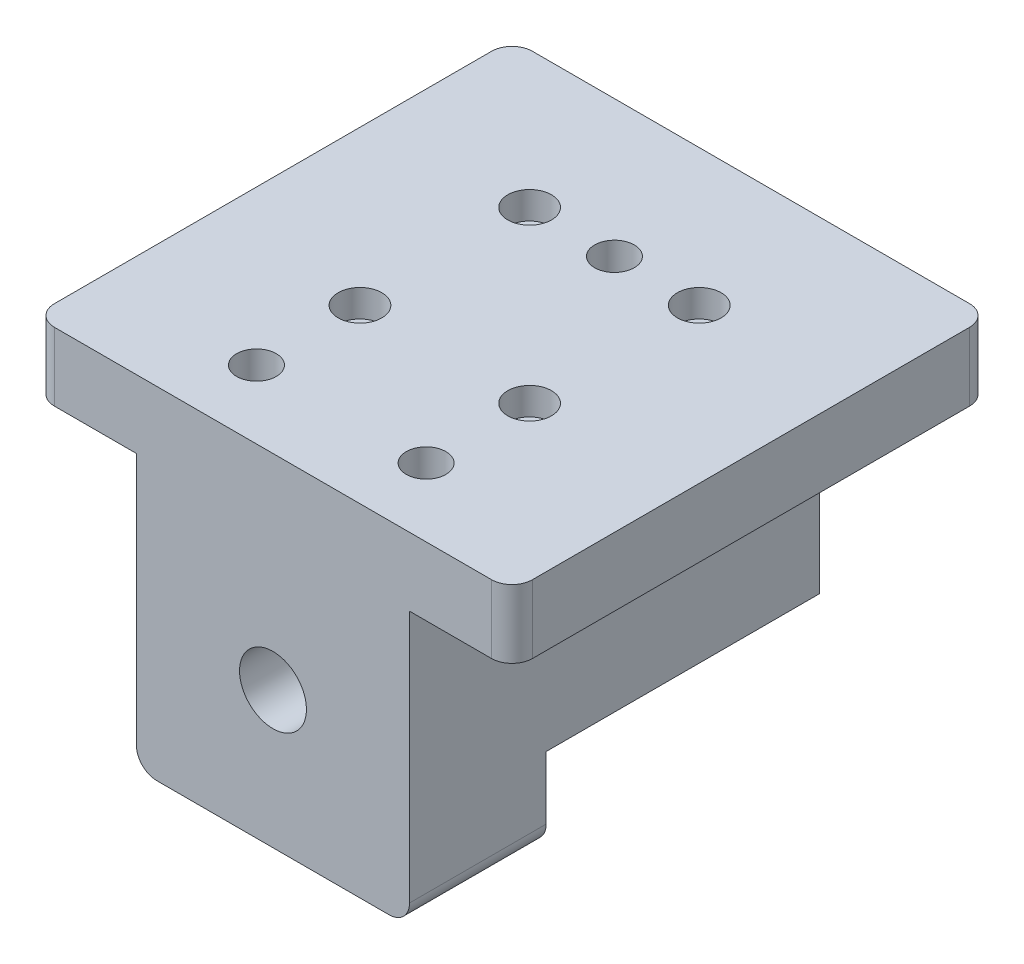
from build123d import *

# Parameters (mm, degrees)
SKETCH1_R                = 2.45
BOSS_EXTRUDE1_DEPTH      = 10
BOSS_EXTRUDE2_DEPTH      = 10
BOSS_EXTRUDE2_DEPTH_BACK = 20
SKETCH7_W                = 35
SKETCH7_H                = 35
BOSS_EXTRUDE10_DEPTH     = 5
SKETCH9_R                = 1.6
CUT_EXTRUDE1_DEPTH       = 2
SKETCH12_R               = 1.45
CUT_EXTRUDE2_DEPTH       = 40.538462287
FILLET3_R                = 1.5


with BuildPart() as part:
    # Sketch1 → Boss-Extrude1 (new body)
    with BuildSketch(Plane.XY):
        with BuildLine():
            ThreePointArc((4.796070709, -3.512623741), (4.371196116, -2.876753977), (4.222, -2.126694449))
            Line((4.222, -2.126694449), (4.222, 1.814694449))
            ThreePointArc((4.222, 1.814694449), (4.371196116, 2.564753977), (4.796070709, 3.20062374))
            Line((4.796070709, 3.20062374), (6.743336362, 5.147889394))
            ThreePointArc((6.743336362, 5.147889394), (6.838716827, 5.211620582), (6.951225756, 5.234))
            Line((6.951225756, 5.234), (8.142, 5.234))
            ThreePointArc((8.142, 5.234), (8.349889394, 5.147889394), (8.436, 4.94))
            Line((8.436, 4.94), (8.436, 3.176))
            ThreePointArc((8.436, 3.176), (8.522110606, 2.968110606), (8.73, 2.882))
            Line((8.73, 2.882), (9.416, 2.882))
            ThreePointArc((9.416, 2.882), (9.623889394, 2.968110606), (9.71, 3.176))
            Line((9.71, 3.176), (9.71, 3.528))
            Line((9.71, 3.528), (9.906, 3.528))
            ThreePointArc((9.906, 3.528), (10.113889394, 3.614110606), (10.2, 3.822))
            Line((10.2, 3.822), (10.2, 8.052))
            Line((10.2, 8.052), (10.2, 9.922))
            Line((10.2, 9.922), (8.608, 9.922))
            Line((8.608, 9.922), (4.1, 9.922))
            ThreePointArc((4.1, 9.922), (3.892110606, 9.835889394), (3.806, 9.628))
            Line((3.806, 9.628), (3.806, 9.432))
            Line((3.806, 9.432), (3.454, 9.432))
            ThreePointArc((3.454, 9.432), (3.246110606, 9.345889394), (3.16, 9.138))
            Line((3.16, 9.138), (3.16, 8.452))
            ThreePointArc((3.16, 8.452), (3.246110606, 8.244110606), (3.454, 8.158))
            Line((3.454, 8.158), (5.218, 8.158))
            ThreePointArc((5.218, 8.158), (5.425889394, 8.071889394), (5.512, 7.864))
            Line((5.512, 7.864), (5.512, 6.673225756))
            ThreePointArc((5.512, 6.673225756), (5.489620583, 6.560716827), (5.425889394, 6.465336362))
            Line((5.425889394, 6.465336362), (3.478623741, 4.518070709))
            ThreePointArc((3.478623741, 4.518070709), (2.842753977, 4.093196116), (2.092694449, 3.944))
            Line((2.092694449, 3.944), (-1.848694449, 3.944))
            ThreePointArc((-1.848694449, 3.944), (-2.598753977, 4.093196116), (-3.234623741, 4.518070709))
            Line((-3.234623741, 4.518070709), (-5.181889394, 6.465336362))
            ThreePointArc((-5.181889394, 6.465336362), (-5.245620582, 6.560716827), (-5.268, 6.673225756))
            Line((-5.268, 6.673225756), (-5.268, 7.864))
            ThreePointArc((-5.268, 7.864), (-5.181889394, 8.071889394), (-4.974, 8.158))
            Line((-4.974, 8.158), (-3.21, 8.158))
            ThreePointArc((-3.21, 8.158), (-3.002110606, 8.244110606), (-2.916, 8.452))
            Line((-2.916, 8.452), (-2.916, 9.138))
            ThreePointArc((-2.916, 9.138), (-3.002110606, 9.345889394), (-3.21, 9.432))
            Line((-3.21, 9.432), (-3.406, 9.432))
            Line((-3.406, 9.432), (-3.406, 9.628))
            ThreePointArc((-3.406, 9.628), (-3.492110606, 9.835889394), (-3.7, 9.922))
            Line((-3.7, 9.922), (-8.33, 9.922))
            Line((-8.33, 9.922), (-9.8, 9.922))
            Line((-9.8, 9.922), (-9.8, 8.33))
            Line((-9.8, 8.33), (-9.8, 3.822))
            ThreePointArc((-9.8, 3.822), (-9.713889394, 3.614110606), (-9.506, 3.528))
            Line((-9.506, 3.528), (-9.31, 3.528))
            Line((-9.31, 3.528), (-9.31, 3.176))
            ThreePointArc((-9.31, 3.176), (-9.223889394, 2.968110606), (-9.016, 2.882))
            Line((-9.016, 2.882), (-8.33, 2.882))
            ThreePointArc((-8.33, 2.882), (-8.122110606, 2.968110606), (-8.036, 3.176))
            Line((-8.036, 3.176), (-8.036, 4.94))
            ThreePointArc((-8.036, 4.94), (-7.949889394, 5.147889394), (-7.742, 5.234))
            Line((-7.742, 5.234), (-6.551225756, 5.234))
            ThreePointArc((-6.551225756, 5.234), (-6.438716827, 5.211620582), (-6.343336362, 5.147889394))
            Line((-6.343336362, 5.147889394), (-4.396070709, 3.20062374))
            ThreePointArc((-4.396070709, 3.20062374), (-3.971196116, 2.564753977), (-3.822, 1.814694449))
            Line((-3.822, 1.814694449), (-3.822, -2.126694449))
            ThreePointArc((-3.822, -2.126694449), (-3.971196116, -2.876753977), (-4.396070709, -3.512623741))
            Line((-4.396070709, -3.512623741), (-6.343336362, -5.459889394))
            ThreePointArc((-6.343336362, -5.459889394), (-6.438716827, -5.523620583), (-6.551225756, -5.546))
            Line((-6.551225756, -5.546), (-7.742, -5.546))
            ThreePointArc((-7.742, -5.546), (-7.949889394, -5.459889394), (-8.036, -5.252))
            Line((-8.036, -5.252), (-8.036, -3.488))
            ThreePointArc((-8.036, -3.488), (-8.122110606, -3.280110606), (-8.33, -3.194))
            Line((-8.33, -3.194), (-9.016, -3.194))
            ThreePointArc((-9.016, -3.194), (-9.223889394, -3.280110606), (-9.31, -3.488))
            Line((-9.31, -3.488), (-9.31, -3.684))
            Line((-9.31, -3.684), (-9.506, -3.684))
            ThreePointArc((-9.506, -3.684), (-9.713889394, -3.770110606), (-9.8, -3.978))
            Line((-9.8, -3.978), (-9.8, -8.486))
            Line((-9.8, -8.486), (-9.8, -10.078))
            Line((-9.8, -10.078), (-8.33, -10.078))
            Line((-8.33, -10.078), (-3.7, -10.078))
            ThreePointArc((-3.7, -10.078), (-3.492110606, -9.991889394), (-3.406, -9.784))
            ThreePointArc((-3.406, -9.784), (-3.348592929, -9.645407071), (-3.21, -9.588))
            ThreePointArc((-3.21, -9.588), (-3.002110606, -9.501889394), (-2.916, -9.294))
            Line((-2.916, -9.294), (-2.916, -8.608))
            ThreePointArc((-2.916, -8.608), (-3.002110606, -8.400110606), (-3.21, -8.314))
            Line((-3.21, -8.314), (-4.974, -8.314))
            ThreePointArc((-4.974, -8.314), (-5.181889394, -8.227889394), (-5.268, -8.02))
            Line((-5.268, -8.02), (-5.268, -6.829225756))
            ThreePointArc((-5.268, -6.829225756), (-5.245620582, -6.716716827), (-5.181889394, -6.621336362))
            Line((-5.181889394, -6.621336362), (-3.234623741, -4.674070709))
            ThreePointArc((-3.234623741, -4.674070709), (-2.598753977, -4.249196116), (-1.848694449, -4.1))
            Line((-1.848694449, -4.1), (2.092694449, -4.1))
            ThreePointArc((2.092694449, -4.1), (2.842753977, -4.249196116), (3.478623741, -4.674070709))
            Line((3.478623741, -4.674070709), (5.425889394, -6.621336362))
            ThreePointArc((5.425889394, -6.621336362), (5.577605011, -6.689573671), (5.668, -6.829225756))
            Line((5.668, -6.829225756), (5.668, -8.02))
            ThreePointArc((5.668, -8.02), (5.581889394, -8.227889394), (5.374, -8.314))
            Line((5.374, -8.314), (3.61, -8.314))
            ThreePointArc((3.61, -8.314), (3.402110606, -8.400110606), (3.316, -8.608))
            Line((3.316, -8.608), (3.316, -9.294))
            ThreePointArc((3.316, -9.294), (3.402110606, -9.501889394), (3.61, -9.588))
            ThreePointArc((3.61, -9.588), (3.748592929, -9.645407071), (3.806, -9.784))
            ThreePointArc((3.806, -9.784), (3.892110606, -9.991889394), (4.1, -10.078))
            Line((4.1, -10.078), (8.608, -10.078))
            Line((8.608, -10.078), (10.2, -10.078))
            Line((10.2, -10.078), (10.2, -8.608))
            Line((10.2, -8.608), (10.2, -3.978))
            ThreePointArc((10.2, -3.978), (10.113889394, -3.770110606), (9.906, -3.684))
            Line((9.906, -3.684), (9.71, -3.684))
            Line((9.71, -3.684), (9.71, -3.488))
            ThreePointArc((9.71, -3.488), (9.623889394, -3.280110606), (9.416, -3.194))
            Line((9.416, -3.194), (8.73, -3.194))
            ThreePointArc((8.73, -3.194), (8.522110606, -3.280110606), (8.436, -3.488))
            Line((8.436, -3.488), (8.436, -5.252))
            ThreePointArc((8.436, -5.252), (8.349889394, -5.459889394), (8.142, -5.546))
            Line((8.142, -5.546), (6.829446968, -5.546))
            Line((6.829446968, -5.546), (4.796070709, -3.512623741))
        make_face()
        with Locations((0.2, -0.078)):
            Circle(SKETCH1_R, mode=Mode.SUBTRACT)
    extrude(amount=BOSS_EXTRUDE1_DEPTH)

    # Sketch1<3> → Boss-Extrude2 (add, two sides: drawn at the far end of the back side and taken through both)
    with BuildSketch(Plane.XY.offset(-BOSS_EXTRUDE2_DEPTH_BACK)):
        with BuildLine():
            Line((4.222, 1.814694449), (4.222, -2.126694449))
            ThreePointArc((4.222, -2.126694449), (4.371196116, -2.876753977), (4.796070709, -3.512623741))
            Line((4.796070709, -3.512623741), (6.829446968, -5.546))
            Line((6.829446968, -5.546), (8.142, -5.546))
            ThreePointArc((8.142, -5.546), (8.349889394, -5.459889394), (8.436, -5.252))
            Line((8.436, -5.252), (8.436, -3.488))
            ThreePointArc((8.436, -3.488), (8.522110606, -3.280110606), (8.73, -3.194))
            Line((8.73, -3.194), (9.416, -3.194))
            ThreePointArc((9.416, -3.194), (9.623889394, -3.280110606), (9.71, -3.488))
            Line((9.71, -3.488), (9.71, -3.684))
            Line((9.71, -3.684), (9.906, -3.684))
            ThreePointArc((9.906, -3.684), (10.113889394, -3.770110606), (10.2, -3.978))
            Line((10.2, -3.978), (10.2, 3.822))
            ThreePointArc((10.2, 3.822), (10.113889394, 3.614110606), (9.906, 3.528))
            Line((9.906, 3.528), (9.71, 3.528))
            Line((9.71, 3.528), (9.71, 3.176))
            ThreePointArc((9.71, 3.176), (9.623889394, 2.968110606), (9.416, 2.882))
            Line((9.416, 2.882), (8.73, 2.882))
            ThreePointArc((8.73, 2.882), (8.522110606, 2.968110606), (8.436, 3.176))
            Line((8.436, 3.176), (8.436, 4.94))
            ThreePointArc((8.436, 4.94), (8.349889394, 5.147889394), (8.142, 5.234))
            Line((8.142, 5.234), (6.951225756, 5.234))
            ThreePointArc((6.951225756, 5.234), (6.838716827, 5.211620582), (6.743336362, 5.147889394))
            Line((6.743336362, 5.147889394), (4.796070709, 3.20062374))
            ThreePointArc((4.796070709, 3.20062374), (4.371196116, 2.564753977), (4.222, 1.814694449))
        make_face()
        with BuildLine():
            Line((-3.7, -10.078), (4.1, -10.078))
            ThreePointArc((4.1, -10.078), (3.892110606, -9.991889394), (3.806, -9.784))
            ThreePointArc((3.806, -9.784), (3.748592929, -9.645407071), (3.61, -9.588))
            ThreePointArc((3.61, -9.588), (3.402110606, -9.501889394), (3.316, -9.294))
            Line((3.316, -9.294), (3.316, -8.608))
            ThreePointArc((3.316, -8.608), (3.402110606, -8.400110606), (3.61, -8.314))
            Line((3.61, -8.314), (5.374, -8.314))
            ThreePointArc((5.374, -8.314), (5.581889394, -8.227889394), (5.668, -8.02))
            Line((5.668, -8.02), (5.668, -6.829225756))
            ThreePointArc((5.668, -6.829225756), (5.577605011, -6.689573671), (5.425889394, -6.621336362))
            Line((5.425889394, -6.621336362), (3.478623741, -4.674070709))
            ThreePointArc((3.478623741, -4.674070709), (2.842753977, -4.249196116), (2.092694449, -4.1))
            Line((2.092694449, -4.1), (-1.848694449, -4.1))
            ThreePointArc((-1.848694449, -4.1), (-2.598753977, -4.249196116), (-3.234623741, -4.674070709))
            Line((-3.234623741, -4.674070709), (-5.181889394, -6.621336362))
            ThreePointArc((-5.181889394, -6.621336362), (-5.245620582, -6.716716827), (-5.268, -6.829225756))
            Line((-5.268, -6.829225756), (-5.268, -8.02))
            ThreePointArc((-5.268, -8.02), (-5.181889394, -8.227889394), (-4.974, -8.314))
            Line((-4.974, -8.314), (-3.21, -8.314))
            ThreePointArc((-3.21, -8.314), (-3.002110606, -8.400110606), (-2.916, -8.608))
            Line((-2.916, -8.608), (-2.916, -9.294))
            ThreePointArc((-2.916, -9.294), (-3.002110606, -9.501889394), (-3.21, -9.588))
            ThreePointArc((-3.21, -9.588), (-3.348592929, -9.645407071), (-3.406, -9.784))
            ThreePointArc((-3.406, -9.784), (-3.492110606, -9.991889394), (-3.7, -10.078))
        make_face()
        with BuildLine():
            ThreePointArc((3.806, 9.628), (3.892110606, 9.835889394), (4.1, 9.922))
            Line((4.1, 9.922), (-3.7, 9.922))
            ThreePointArc((-3.7, 9.922), (-3.492110606, 9.835889394), (-3.406, 9.628))
            Line((-3.406, 9.628), (-3.406, 9.432))
            Line((-3.406, 9.432), (-3.21, 9.432))
            ThreePointArc((-3.21, 9.432), (-3.002110606, 9.345889394), (-2.916, 9.138))
            Line((-2.916, 9.138), (-2.916, 8.452))
            ThreePointArc((-2.916, 8.452), (-3.002110606, 8.244110606), (-3.21, 8.158))
            Line((-3.21, 8.158), (-4.974, 8.158))
            ThreePointArc((-4.974, 8.158), (-5.181889394, 8.071889394), (-5.268, 7.864))
            Line((-5.268, 7.864), (-5.268, 6.673225756))
            ThreePointArc((-5.268, 6.673225756), (-5.245620582, 6.560716827), (-5.181889394, 6.465336362))
            Line((-5.181889394, 6.465336362), (-3.234623741, 4.518070709))
            ThreePointArc((-3.234623741, 4.518070709), (-2.598753977, 4.093196116), (-1.848694449, 3.944))
            Line((-1.848694449, 3.944), (2.092694449, 3.944))
            ThreePointArc((2.092694449, 3.944), (2.842753977, 4.093196116), (3.478623741, 4.518070709))
            Line((3.478623741, 4.518070709), (5.425889394, 6.465336362))
            ThreePointArc((5.425889394, 6.465336362), (5.489620583, 6.560716827), (5.512, 6.673225756))
            Line((5.512, 6.673225756), (5.512, 7.864))
            ThreePointArc((5.512, 7.864), (5.425889394, 8.071889394), (5.218, 8.158))
            Line((5.218, 8.158), (3.454, 8.158))
            ThreePointArc((3.454, 8.158), (3.246110606, 8.244110606), (3.16, 8.452))
            Line((3.16, 8.452), (3.16, 9.138))
            ThreePointArc((3.16, 9.138), (3.246110606, 9.345889394), (3.454, 9.432))
            Line((3.454, 9.432), (3.806, 9.432))
            Line((3.806, 9.432), (3.806, 9.628))
        make_face()
        with BuildLine():
            Line((-9.8, 3.822), (-9.8, -3.978))
            ThreePointArc((-9.8, -3.978), (-9.713889394, -3.770110606), (-9.506, -3.684))
            Line((-9.506, -3.684), (-9.31, -3.684))
            Line((-9.31, -3.684), (-9.31, -3.488))
            ThreePointArc((-9.31, -3.488), (-9.223889394, -3.280110606), (-9.016, -3.194))
            Line((-9.016, -3.194), (-8.33, -3.194))
            ThreePointArc((-8.33, -3.194), (-8.122110606, -3.280110606), (-8.036, -3.488))
            Line((-8.036, -3.488), (-8.036, -5.252))
            ThreePointArc((-8.036, -5.252), (-7.949889394, -5.459889394), (-7.742, -5.546))
            Line((-7.742, -5.546), (-6.551225756, -5.546))
            ThreePointArc((-6.551225756, -5.546), (-6.438716827, -5.523620583), (-6.343336362, -5.459889394))
            Line((-6.343336362, -5.459889394), (-4.396070709, -3.512623741))
            ThreePointArc((-4.396070709, -3.512623741), (-3.971196116, -2.876753977), (-3.822, -2.126694449))
            Line((-3.822, -2.126694449), (-3.822, 1.814694449))
            ThreePointArc((-3.822, 1.814694449), (-3.971196116, 2.564753977), (-4.396070709, 3.20062374))
            Line((-4.396070709, 3.20062374), (-6.343336362, 5.147889394))
            ThreePointArc((-6.343336362, 5.147889394), (-6.438716827, 5.211620582), (-6.551225756, 5.234))
            Line((-6.551225756, 5.234), (-7.742, 5.234))
            ThreePointArc((-7.742, 5.234), (-7.949889394, 5.147889394), (-8.036, 4.94))
            Line((-8.036, 4.94), (-8.036, 3.176))
            ThreePointArc((-8.036, 3.176), (-8.122110606, 2.968110606), (-8.33, 2.882))
            Line((-8.33, 2.882), (-9.016, 2.882))
            ThreePointArc((-9.016, 2.882), (-9.223889394, 2.968110606), (-9.31, 3.176))
            Line((-9.31, 3.176), (-9.31, 3.528))
            Line((-9.31, 3.528), (-9.506, 3.528))
            ThreePointArc((-9.506, 3.528), (-9.713889394, 3.614110606), (-9.8, 3.822))
        make_face()
    extrude(amount=BOSS_EXTRUDE2_DEPTH + BOSS_EXTRUDE2_DEPTH_BACK)

    # Sketch7 → Boss-Extrude10 (add)
    with BuildSketch(Plane(origin=(0, 9.922, 0), x_dir=(1, 0, 0), z_dir=(0, 1, 0))):
        with Locations((0.2, 7.5)):
            Rectangle(SKETCH7_W, SKETCH7_H)
    extrude(amount=BOSS_EXTRUDE10_DEPTH)

    # Sketch9 → Cut-Extrude1 (cut)
    with BuildSketch(Plane(origin=(0, 14.922, 0), x_dir=(1, 0, 0), z_dir=(0, 1, 0))):
        with Locations((6.41, 15)):
            Circle(SKETCH9_R)
        with Locations((-6.01, 15)):
            Circle(SKETCH9_R)
        with Locations((-6.01, 2.58)):
            Circle(SKETCH9_R)
        with Locations((6.41, 2.58)):
            Circle(SKETCH9_R)
    extrude(amount=-CUT_EXTRUDE1_DEPTH, mode=Mode.SUBTRACT)

    # Sketch12 → Cut-Extrude2 (cut, through all)
    with BuildSketch(Plane(origin=(0, 14.922, 0), x_dir=(1, 0, 0), z_dir=(0, 1, 0))):
        with Locations((0.2, 15)):
            Circle(SKETCH12_R)
        with Locations((-6.01, -5)):
            Circle(SKETCH12_R)
        with Locations((6.41, -5)):
            Circle(SKETCH12_R)
    extrude(amount=-CUT_EXTRUDE2_DEPTH, mode=Mode.SUBTRACT)

    # Fillet3
    fillet3_edges = [part.edges().sort_by_distance(p)[0] for p in [
        (10.2, -10.078, 5),
        (-9.8, -10.078, 5),
        (-17.3, 12.422, -25),
        (-17.3, 12.422, 10),
        (17.7, 12.422, -25),
        (17.7, 12.422, 10),
    ]]
    fillet(fillet3_edges, radius=FILLET3_R)


solid = part.part
